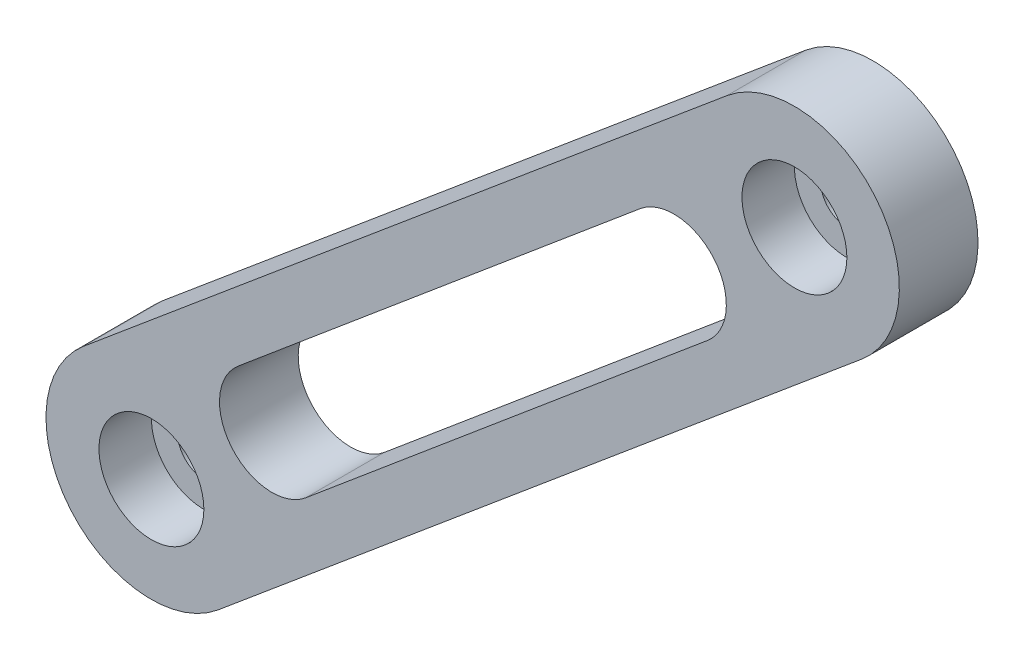
from build123d import *

# Parameters (mm, degrees)
SKETCH1_R           = 6.35
BOSS_EXTRUDE1_DEPTH = 19.05
SKETCH2_R           = 12.7
CUT_EXTRUDE1_DEPTH  = 12.7


with BuildPart() as part:
    # Sketch1 → Boss-Extrude1 (new body)
    with BuildSketch(Plane.XY):
        with BuildLine():
            Line((563.002200255, 498.705502976), (407.213769988, 368.244654123))
            ThreePointArc((407.213769988, 368.244654123), (404.047819828, 332.463420723), (439.829052993, 329.297467903))
            Line((439.829052993, 329.297467903), (595.617480365, 459.758314331))
            ThreePointArc((595.617480365, 459.758314331), (598.783434633, 495.539548709), (563.002200255, 498.705502976))
        make_face()
        with Locations(Location((423.649859525, 348.617676187, 0), (0, 0, 180))):
            Circle(SKETCH1_R, mode=Mode.SUBTRACT)
        with Locations(Location((579.30984031, 479.231908654, 0), (0, 0, 180))):
            Circle(SKETCH1_R, mode=Mode.SUBTRACT)
        with BuildLine():
            Line((558.286949671, 445.012936297), (460.999305394, 363.378909867))
            ThreePointArc((460.999305394, 363.378909867), (443.107138324, 364.944271651), (444.672500108, 382.836438722))
            Line((444.672500108, 382.836438722), (541.960144385, 464.470465152))
            ThreePointArc((541.960144385, 464.470465152), (559.852311455, 462.905103368), (558.286949671, 445.012936297))
        make_face(mode=Mode.SUBTRACT)
    extrude(amount=BOSS_EXTRUDE1_DEPTH)

    # Sketch2 → Cut-Extrude1 (cut)
    with BuildSketch(Plane.XY.offset(19.05)):
        with Locations((423.649859525, 348.617676187)):
            Circle(SKETCH2_R)
        with Locations((579.30984031, 479.231908654)):
            Circle(SKETCH2_R)
    extrude(amount=-CUT_EXTRUDE1_DEPTH, mode=Mode.SUBTRACT)


solid = part.part
